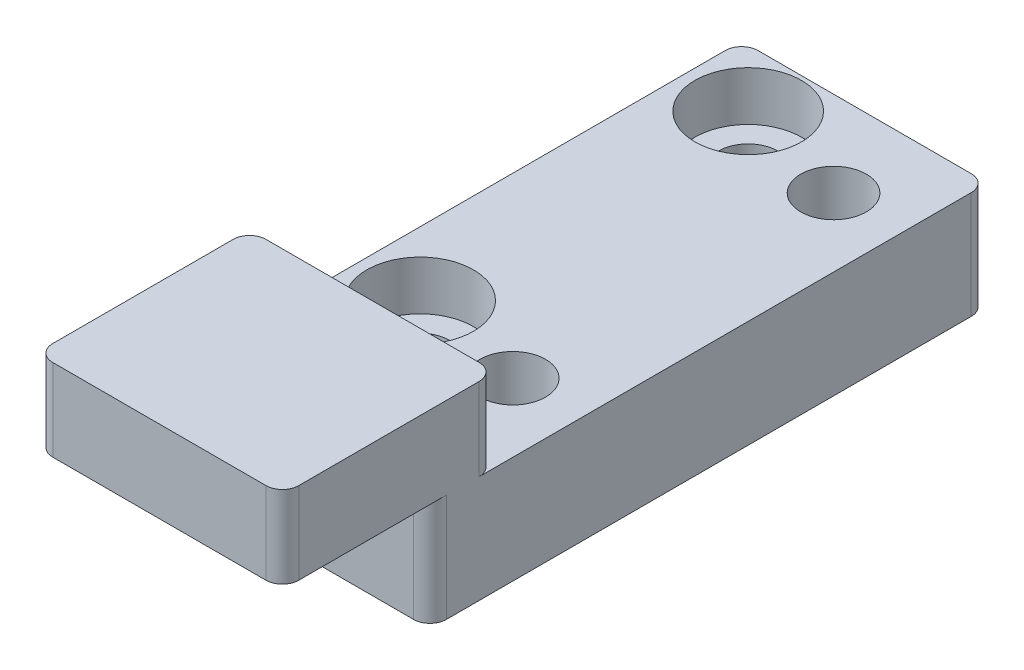
from build123d import *

# Parameters (mm, degrees)
SKETCH1_W                                      = 15
SKETCH1_H                                      = 6.539
BOSS_EXTRUDE1_DEPTH                            = 30
CBORE_FOR_M3_SHCS1_D                           = 3.6
CBORE_FOR_M3_SHCS1_CBORE_D                     = 6.5
CBORE_FOR_M3_SHCS1_CBORE_DEPTH                 = 3
CBORE_FOR_6_SOCKET_HEAD_CAP_SCREW1_D           = 3.997300108
CBORE_FOR_6_SOCKET_HEAD_CAP_SCREW1_CBORE_D     = 7.14502
CBORE_FOR_6_SOCKET_HEAD_CAP_SCREW1_CBORE_DEPTH = 3.5052
BOSS_EXTRUDE2_DEPTH                            = 15
FILLET1_R                                      = 1


with BuildPart() as part:
    # Sketch1 → Boss-Extrude1 (new body)
    with BuildSketch(Plane.XY):
        with Locations((7.5, 3.2695)):
            Rectangle(SKETCH1_W, SKETCH1_H)
    extrude(amount=BOSS_EXTRUDE1_DEPTH)

    # CBORE for M3 SHCS1 (through all)
    with Locations(Plane(origin=(0, 6.539, 0), x_dir=(1, 0, 0), z_dir=(0, 1, 0))):
        with Locations((3.9, -3.5), (3.9, -23.5)):
            CounterBoreHole(CBORE_FOR_M3_SHCS1_D / 2, CBORE_FOR_M3_SHCS1_CBORE_D / 2, CBORE_FOR_M3_SHCS1_CBORE_DEPTH)

    # CBORE for #6 Socket Head Cap Screw1 (through all)
    with Locations(Plane(origin=(0, 0, 0), x_dir=(-1, 0, 0), z_dir=(0, -1, 0))):
        with Locations((-10.825, -24.779), (-10.825, -5.221)):
            CounterBoreHole(CBORE_FOR_6_SOCKET_HEAD_CAP_SCREW1_D / 2, CBORE_FOR_6_SOCKET_HEAD_CAP_SCREW1_CBORE_D / 2, CBORE_FOR_6_SOCKET_HEAD_CAP_SCREW1_CBORE_DEPTH)

    # Sketch6 → Boss-Extrude2 (add)
    with BuildSketch(Plane(origin=(15, 0, 0), x_dir=(0, 0, -1), z_dir=(1, 0, 0))):
        Polygon((-30, 0), (-34, 0), (-34, 6.569), (-43, 6.569), (-43, 11.569), (-30, 11.569), align=None)
    extrude(amount=-BOSS_EXTRUDE2_DEPTH)

    # Fillet1
    fillet1_edges = [part.edges().sort_by_distance(p)[0] for p in [
        (15, 9.054, 30),
        (15, 9.069, 43),
        (15, 3.2845, 34),
        (0, 9.054, 30),
        (0, 3.2845, 34),
        (0, 9.069, 43),
        (15, 3.2695, 0),
        (0, 3.2695, 0),
    ]]
    fillet(fillet1_edges, radius=FILLET1_R)


solid = part.part
